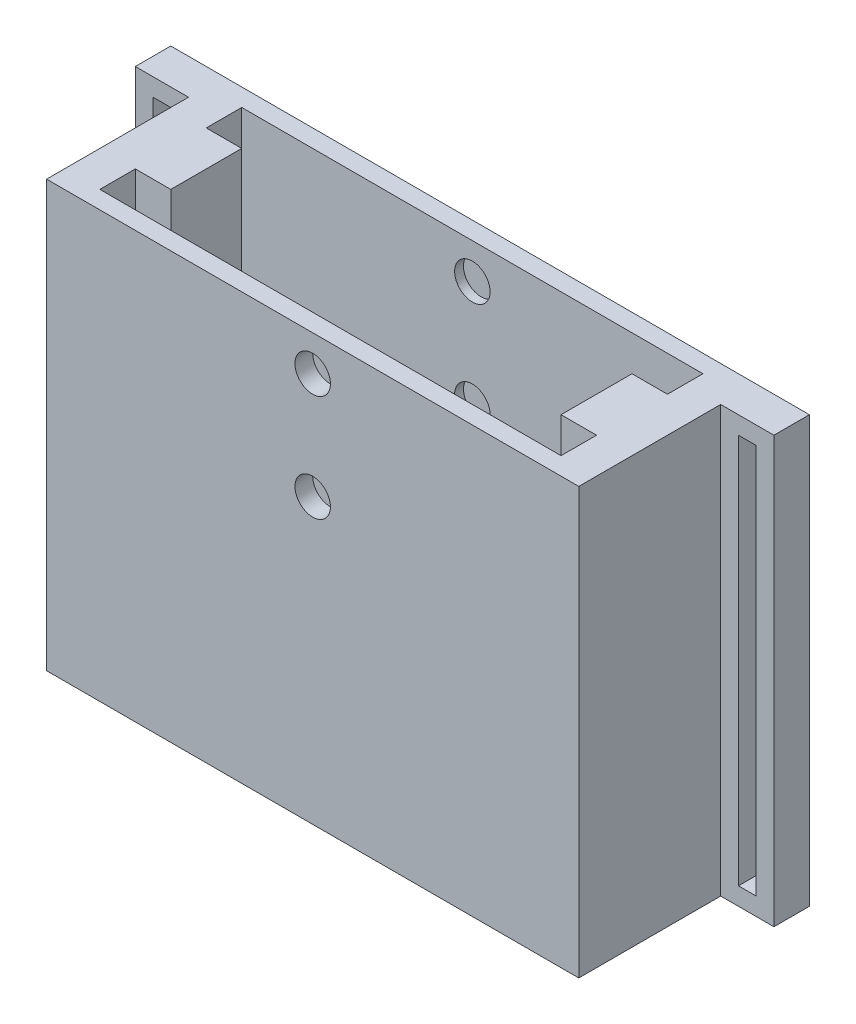
from build123d import *

# Parameters (mm, degrees)
SKETCH1_W           = 150
SKETCH1_H           = 120
BODY_DEPTH          = 50
SPINE_SOCKET_DEPTH  = 151.083310198
SKETCH3_R           = 5
CUT_EXTRUDE2_DEPTH  = 47.5
SKETCH4_W           = 15
SKETCH4_H           = 120
SKETCH4_W_2         = 5
SKETCH4_H_2         = 110
BOSS_EXTRUDE2_DEPTH = 10


with BuildPart() as part:
    # Sketch1 → body (new body)
    with BuildSketch(Plane.XY):
        with Locations((0, 60)):
            Rectangle(SKETCH1_W, SKETCH1_H)
    extrude(amount=BODY_DEPTH)

    # Sketch2 → spine socket (cut, through all)
    with BuildSketch(Plane(origin=(0, 120, 0), x_dir=(1, 0, 0), z_dir=(0, 1, 0))):
        Polygon((-65, -5), (-65, -15), (-55, -15), (-55, -35), (-65, -35), (-65, -45), (65, -45), (65, -35), (55, -35), (55, -15), (65, -15), (65, -5), align=None)
    extrude(amount=-SPINE_SOCKET_DEPTH, mode=Mode.SUBTRACT)

    # Sketch3 → Cut-Extrude2 (cut)
    with BuildSketch(Plane.XY.offset(50)):
        with Locations((0, 110)):
            Circle(SKETCH3_R)
        with Locations((0, 80)):
            Circle(SKETCH3_R)
    extrude(amount=-CUT_EXTRUDE2_DEPTH, mode=Mode.SUBTRACT)

    # Sketch4 → Boss-Extrude2 (add)
    # profile 1 of 2: a face of its own
    with BuildSketch(Plane(origin=(0, 0, 0), x_dir=(-1, 0, 0), z_dir=(0, 0, -1))):
        with Locations((-82.5, 60)):
            Rectangle(SKETCH4_W, SKETCH4_H)
        with Locations((-82.5, 60)):
            Rectangle(SKETCH4_W_2, SKETCH4_H_2, mode=Mode.SUBTRACT)
    # profile 2 of 2: a face of its own
    with BuildSketch(Plane(origin=(0, 0, 0), x_dir=(-1, 0, 0), z_dir=(0, 0, -1))):
        with Locations((82.5, 60)):
            Rectangle(SKETCH4_W, SKETCH4_H)
        with Locations((82.5, 60)):
            Rectangle(SKETCH4_W_2, SKETCH4_H_2, mode=Mode.SUBTRACT)
    extrude(amount=-BOSS_EXTRUDE2_DEPTH)


solid = part.part
